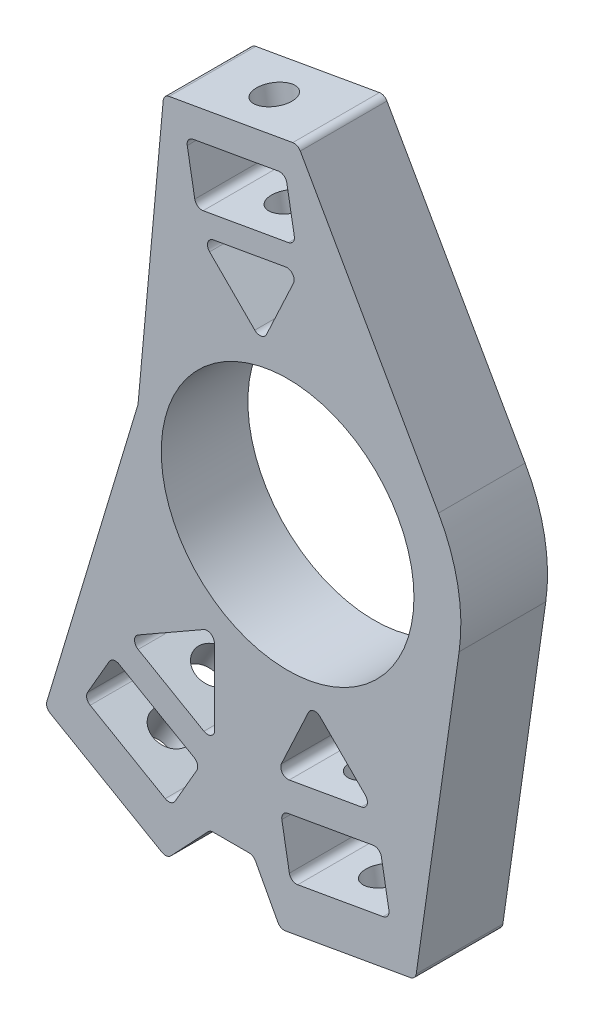
from build123d import *

# Parameters (mm, degrees)
BOSS_EXTRUDE1_DEPTH = 12
SKETCH2_5_R         = 17.5
CUT_EXTRUDE1_DEPTH  = 61.62435091
CUT_EXTRUDE2_DEPTH  = 61.62435091
FILLET2_R           = 1
SKETCH5_R           = 2.5
CUT_EXTRUDE3_DEPTH  = 20
SKETCH6_R           = 2.5
CUT_EXTRUDE4_DEPTH  = 20
SKETCH7_R           = 2.5
CUT_EXTRUDE5_DEPTH  = 20


with BuildPart() as part:
    # Sketch2 → Boss-Extrude1 (new body)
    with BuildSketch(Plane.XY):
        with BuildLine():
            Line((20.894470269, 11.807671751), (1.412805817, 46.281788856))
            Line((1.412805817, 46.281788856), (-17.156907259, 43.007447417))
            Line((-17.156907259, 43.007447417), (-20.719877005, 4.022649671))
            Line((-20.719877005, 4.022649671), (-33.575613753, -38.686924938))
            Line((-33.575613753, -38.686924938), (-16.716052914, -48.420796926))
            Line((-16.716052914, -48.420796926), (-10.73162709, -42.058723264))
            Line((-10.73162709, -42.058723264), (-4.73162709, -42.058723264))
            Line((-4.73162709, -42.058723264), (-1.004945592, -49.030501572))
            Line((-1.004945592, -49.030501572), (17.713759132, -45.729888885))
            Line((17.713759132, -45.729888885), (23.759018728, -3.392495999))
            ThreePointArc((23.759018728, -3.392495999), (23.58484248, 4.444682801), (20.894470269, 11.807671751))
        make_face()
    extrude(amount=BOSS_EXTRUDE1_DEPTH)

    # Sketch2<5> → Cut-Extrude1 (cut, through all)
    with BuildSketch(Plane.XY):
        Circle(SKETCH2_5_R)
    extrude(amount=CUT_EXTRUDE1_DEPTH, mode=Mode.SUBTRACT)

    # Sketch4 → Cut-Extrude2 (cut, through all)
    with BuildSketch(Plane(origin=(0, 0, 0), x_dir=(-1, 0, 0), z_dir=(0, 0, -1))):
        with BuildLine():
            Line((16.949680911, -41.357708509), (27.341985756, -35.357708509))
            ThreePointArc((27.341985756, -35.357708509), (27.807911582, -34.750502151), (27.70801116, -33.991683106))
            Line((27.70801116, -33.991683106), (24.70801116, -28.795530683))
            ThreePointArc((24.70801116, -28.795530683), (24.100804801, -28.329604857), (23.341985756, -28.429505279))
            Line((23.341985756, -28.429505279), (12.949680911, -34.429505279))
            ThreePointArc((12.949680911, -34.429505279), (12.483755084, -35.036711638), (12.583655507, -35.795530683))
            Line((12.583655507, -35.795530683), (15.583655507, -40.991683106))
            ThreePointArc((15.583655507, -40.991683106), (16.190861866, -41.457608932), (16.949680911, -41.357708509))
        make_face()
        with BuildLine():
            Line((11.591437777, -30.594885164), (20.70022889, -25.335922163))
            ThreePointArc((20.70022889, -25.335922163), (21.200226386, -24.467658925), (20.696347848, -23.601642201))
            Line((20.696347848, -23.601642201), (11.63426972, -18.423588462))
            ThreePointArc((11.63426972, -18.423588462), (10.638150761, -18.425817617), (10.138160777, -19.287367363))
            Line((10.138160777, -19.287367363), (10.091447793, -29.724384103))
            ThreePointArc((10.091447793, -29.724384103), (10.589501007, -30.593764079), (11.591437777, -30.594885164))
        make_face()
        with BuildLine():
            Line((-13.221364222, -40.429459644), (-1.403671186, -42.513237776))
            ThreePointArc((-1.403671186, -42.513237776), (-0.656446572, -42.347582067), (-0.245215255, -41.702078201))
            Line((-0.245215255, -41.702078201), (0.796673811, -35.793231683))
            ThreePointArc((0.796673811, -35.793231683), (0.631018102, -35.046007069), (-0.014485765, -34.634775752))
            Line((-0.014485765, -34.634775752), (-11.832178801, -32.55099762))
            ThreePointArc((-11.832178801, -32.55099762), (-12.579403415, -32.716653329), (-12.990634731, -33.362157195))
            Line((-12.990634731, -33.362157195), (-14.032523797, -39.271003713))
            ThreePointArc((-14.032523797, -39.271003713), (-13.866868089, -40.018228328), (-13.221364222, -40.429459644))
        make_face()
        with BuildLine():
            ThreePointArc((-10.764474433, -27.079820723), (-11.010965186, -28.087601228), (-10.230917355, -28.771636769))
            Line((-10.230917355, -28.771636769), (-0.226561789, -30.53567458))
            ThreePointArc((-0.226561789, -30.53567458), (0.740397335, -30.159683501), (0.853453027, -29.128374794))
            Line((0.853453027, -29.128374794), (-2.888697749, -21.100387627))
            ThreePointArc((-2.888697749, -21.100387627), (-3.621416209, -20.538071906), (-4.502269642, -20.815871366))
            Line((-4.502269642, -20.815871366), (-10.764474433, -27.079820723))
        make_face()
        with BuildLine():
            Line((-0.120573929, 33.868814166), (11.697119107, 31.785036034))
            ThreePointArc((11.697119107, 31.785036034), (12.444343721, 31.950691743), (12.855575038, 32.59619561))
            Line((12.855575038, 32.59619561), (13.897464104, 38.505042128))
            ThreePointArc((13.897464104, 38.505042128), (13.731808395, 39.252266742), (13.086304528, 39.663498059))
            Line((13.086304528, 39.663498059), (1.268611492, 41.747276191))
            ThreePointArc((1.268611492, 41.747276191), (0.521386878, 41.581620482), (0.110155561, 40.936116615))
            Line((0.110155561, 40.936116615), (-0.931733505, 35.027270097))
            ThreePointArc((-0.931733505, 35.027270097), (-0.766077796, 34.280045483), (-0.120573929, 33.868814166))
        make_face()
        with BuildLine():
            ThreePointArc((0.265150273, 30.754520747), (-0.701808851, 30.378529668), (-0.814864543, 29.347220961))
            Line((-0.814864543, 29.347220961), (2.927286233, 21.319233794))
            ThreePointArc((2.927286233, 21.319233794), (3.660004693, 20.756918074), (4.540858126, 21.034717534))
            Line((4.540858126, 21.034717534), (10.803062917, 27.29866689))
            ThreePointArc((10.803062917, 27.29866689), (11.04955367, 28.306447396), (10.269505839, 28.990482936))
            Line((10.269505839, 28.990482936), (0.265150273, 30.754520747))
        make_face()
    extrude(amount=-CUT_EXTRUDE2_DEPTH, mode=Mode.SUBTRACT)

    # Fillet2
    fillet2_edges = [part.edges().sort_by_distance(p)[0] for p in [
        (17.713759132, -45.729888885, 6),
        (-1.004945592, -49.030501572, 6),
        (-10.73162709, -42.058723264, 6),
        (-4.73162709, -42.058723264, 6),
        (-16.716052914, -48.420796926, 6),
        (-33.575613753, -38.686924938, 6),
        (-17.156907259, 43.007447417, 6),
        (1.412805817, 46.281788856, 6),
    ]]
    fillet(fillet2_edges, radius=FILLET2_R)

    # Sketch5 → Cut-Extrude3 (cut)
    with BuildSketch(Plane(origin=(8.35440677, -47.380195228, 0), x_dir=(0.9848077530122075, 0.17364817766693383, 0), z_dir=(0.17364817766693386, -0.9848077530122076, 0))):
        with Locations((0, 6)):
            Circle(SKETCH5_R)
    extrude(amount=-CUT_EXTRUDE3_DEPTH, mode=Mode.SUBTRACT)

    # Sketch6 → Cut-Extrude4 (cut)
    with BuildSketch(Plane(origin=(-25.145833333, -43.553860932, 0), x_dir=(0.86602540378444, -0.4999999999999975, 0), z_dir=(-0.4999999999999975, -0.86602540378444, 0))):
        with Locations((0, 6)):
            Circle(SKETCH6_R)
    extrude(amount=-CUT_EXTRUDE4_DEPTH, mode=Mode.SUBTRACT)

    # Sketch7 → Cut-Extrude5 (cut)
    with BuildSketch(Plane(origin=(-7.872050721, 44.644618137, 0), x_dir=(0.9848077530122087, 0.17364817766692725, 0), z_dir=(-0.17364817766692725, 0.9848077530122087, 0))):
        with Locations((0.028573577, -6)):
            Circle(SKETCH7_R)
    extrude(amount=-CUT_EXTRUDE5_DEPTH, mode=Mode.SUBTRACT)


solid = part.part
